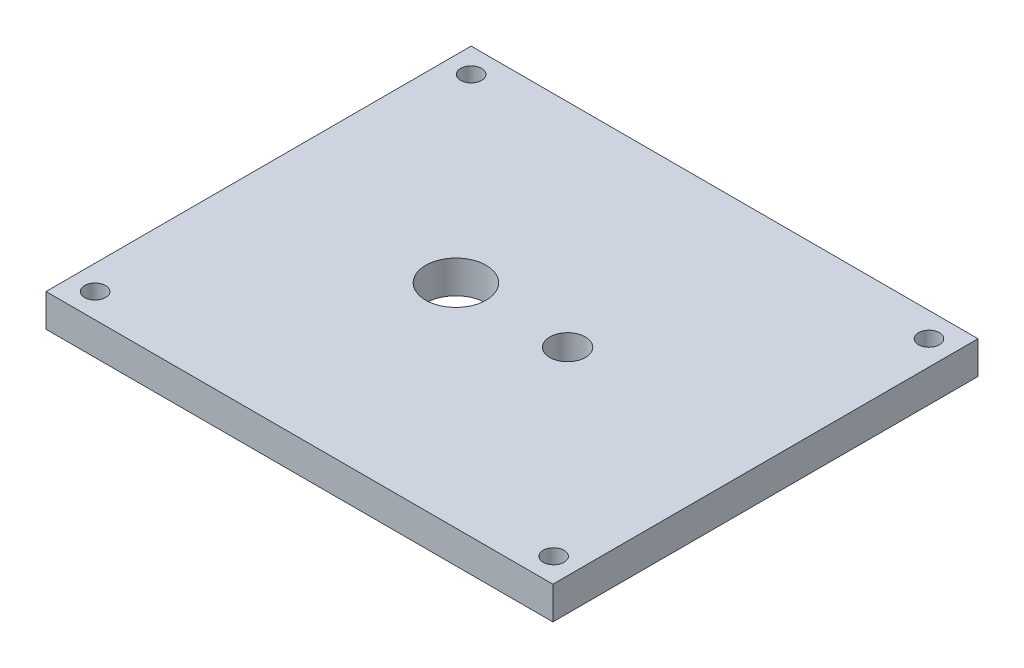
from build123d import *

# Parameters (mm, degrees)
SKETCH1_W             = 78.74
SKETCH1_H             = 66.04
BOSS_EXTRUDE1_DEPTH   = 5.08
SKETCH2_R             = 4.699
SKETCH2_R_2           = 2.7686
CUT_EXTRUDE1_DEPTH    = 5.08
F_4_CLEARANCE_HOLE1_D = 3.2512


with BuildPart() as part:
    # Sketch1 → Boss-Extrude1 (new body)
    with BuildSketch(Plane(origin=(0, 0, 0), x_dir=(1, 0, 0), z_dir=(0, 1, 0))):
        Rectangle(SKETCH1_W, SKETCH1_H)
    extrude(amount=BOSS_EXTRUDE1_DEPTH)

    # Sketch2 → Cut-Extrude1 (cut)
    with BuildSketch(Plane(origin=(0, 5.08, 0), x_dir=(1, 0, 0), z_dir=(0, 1, 0))):
        with Locations(Location((-8.7122, 0, 0), (0, 0, 270))):
            Circle(SKETCH2_R)
        with Locations(Location((8.636, 0, 0), (0, 0, 270))):
            Circle(SKETCH2_R_2)
    extrude(amount=-CUT_EXTRUDE1_DEPTH, mode=Mode.SUBTRACT)

    # #4 Clearance Hole1 (through all)
    with Locations(Plane(origin=(0, 5.08, 0), x_dir=(1, 0, 0), z_dir=(0, 1, 0))):
        with Locations((-35.56, 29.21), (-35.56, -29.21), (35.676601494, -29.21), (35.56, 29.21)):
            Hole(F_4_CLEARANCE_HOLE1_D / 2)


solid = part.part
